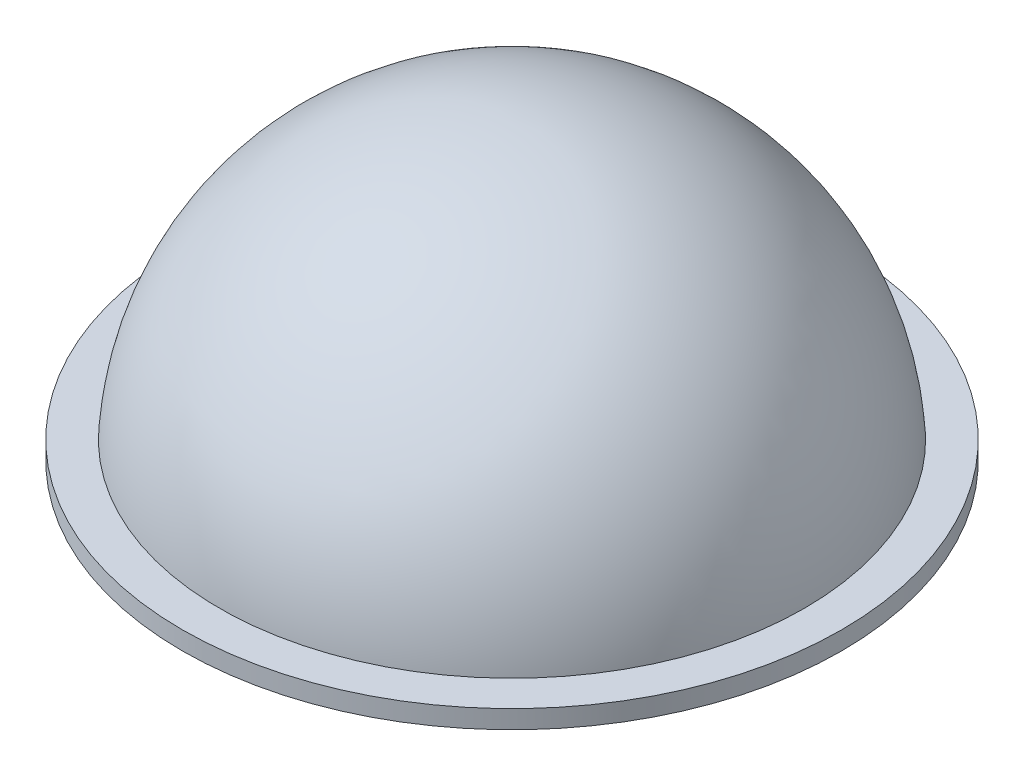
from build123d import *


with BuildPart() as part:
    # Sketch1 → Revolve1 (revolve)
    with BuildSketch(Plane.XY):
        with BuildLine():
            Line((-90, 0), (-90, 5))
            Line((-90, 5), (-79.843597113, 5))
            ThreePointArc((-79.843597113, 5), (-54.772255751, 58.309518948), (0, 80))
            Line((0, 80), (0, 75))
            ThreePointArc((0, 75), (-53.033008589, 53.033008589), (-75, 0))
            Line((-75, 0), (-90, 0))
        make_face()
    revolve(axis=Axis((0, 0, 0), (0, 1, 0)))


solid = part.part
